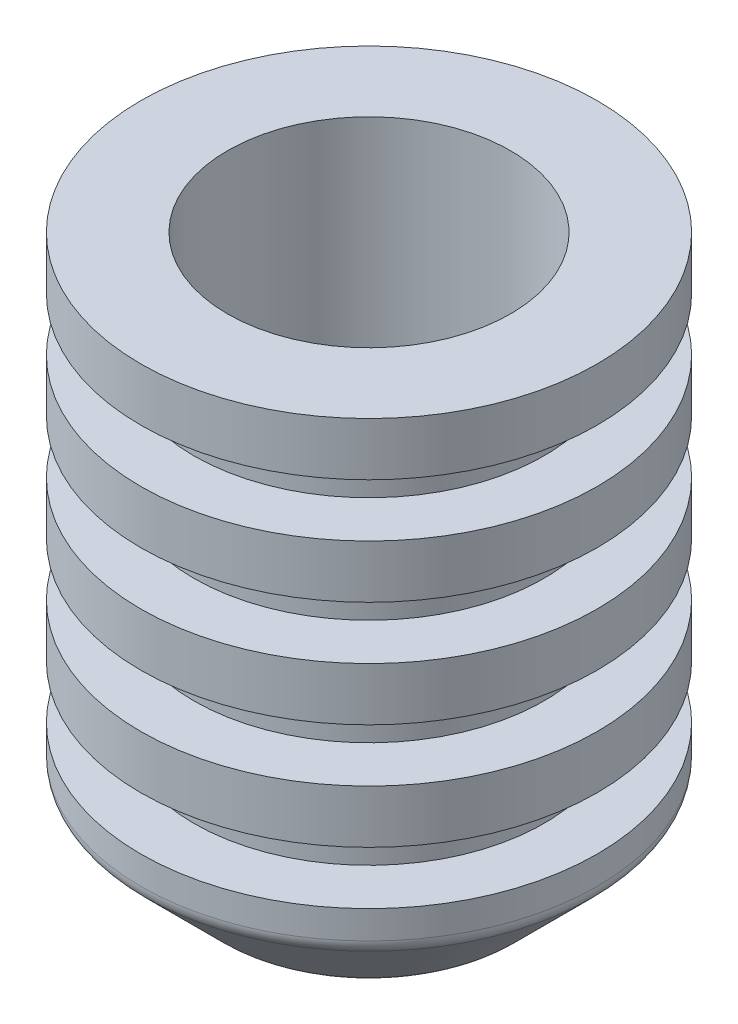
from build123d import *

# Parameters (mm, degrees)
SKETCH_1_R          = 12.9
EXTRUDE_1_DEPTH     = 31
SKETCH_2_R          = 8
CUT_EXTRUDE_1_DEPTH = 25
CHAMFER_1_SIZE      = 5
FILLET_1_R          = 1
SKETCH_3_W          = 3
SKETCH_3_H          = 3


with BuildPart() as part:
    # 草图1 → 凸台-拉伸1 (new body)
    with BuildSketch(Plane(origin=(0, 0, 0), x_dir=(1, 0, 0), z_dir=(0, 1, 0))):
        with Locations(Location((0, 0, 0), (0, 0, 270))):
            Circle(SKETCH_1_R)
    extrude(amount=EXTRUDE_1_DEPTH)

    # 草图2 → 切除-拉伸1 (cut)
    with BuildSketch(Plane(origin=(0, 31, 0), x_dir=(1, 0, 0), z_dir=(0, 1, 0))):
        with Locations(Location((0, 0, 0), (0, 0, 270))):
            Circle(SKETCH_2_R)
    extrude(amount=-CUT_EXTRUDE_1_DEPTH, mode=Mode.SUBTRACT)

    # 倒角1
    chamfer_1_edges = [part.edges().sort_by_distance(p)[0] for p in [
        (0, 0, -12.9),
    ]]
    chamfer(chamfer_1_edges, length=CHAMFER_1_SIZE)

    # 圆角1
    fillet_1_edges = [part.edges().sort_by_distance(p)[0] for p in [
        (0, 0, -7.9),
        (0, 5, -12.9),
    ]]
    fillet(fillet_1_edges, radius=FILLET_1_R)

    # 草图3 → 切除-旋转1 (revolve, cut)
    with BuildSketch(Plane.XY, mode=Mode.PRIVATE) as cut_revolve_1_sk:
        with Locations((11.4, 26.5)):
            Rectangle(SKETCH_3_W, SKETCH_3_H)
        with Locations((11.4, 20.5)):
            Rectangle(SKETCH_3_W, SKETCH_3_H)
        with Locations((11.4, 14.5)):
            Rectangle(SKETCH_3_W, SKETCH_3_H)
        with Locations((11.4, 8.5)):
            Rectangle(SKETCH_3_W, SKETCH_3_H)
    revolve(cut_revolve_1_sk.sketch.rotate(Axis((0, 0, 0), (0, 1, 0)), 90), axis=Axis((0, 0, 0), (0, 1, 0)), mode=Mode.SUBTRACT)


solid = part.part
